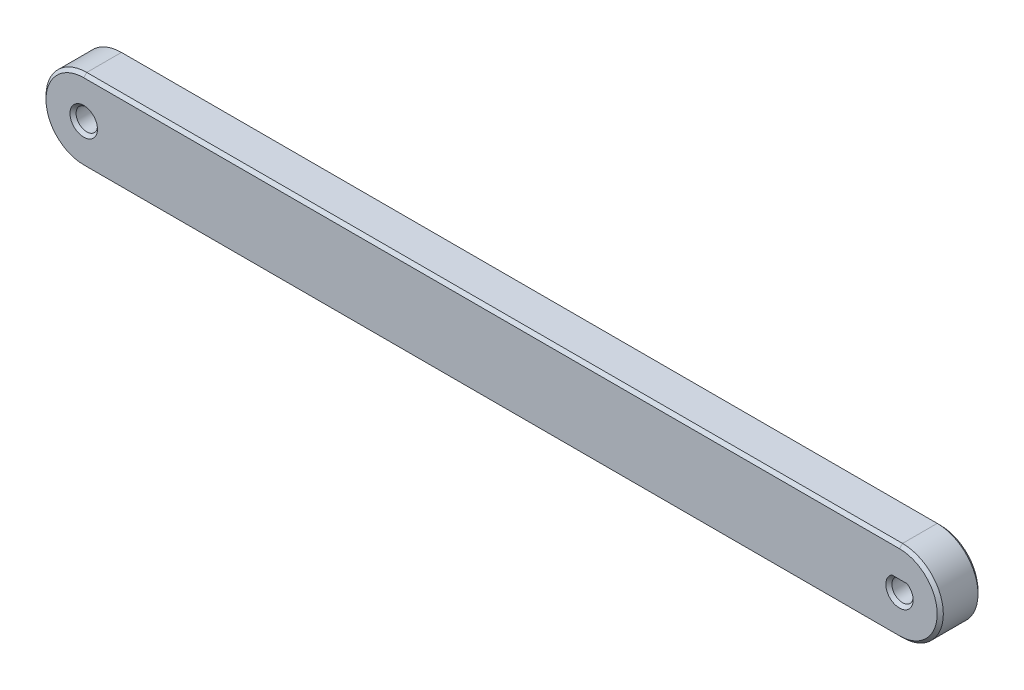
from build123d import *

# Parameters (mm, degrees)
SKETCH1_R           = 2.625
BOSS_EXTRUDE1_DEPTH = 10
SKETCH2_R           = 6.5
CUT_EXTRUDE1_DEPTH  = 4
CHAMFER1_SIZE       = 0.75


with BuildPart() as part:
    # Sketch1 → Boss-Extrude1 (new body)
    with BuildSketch(Plane.XY):
        with BuildLine():
            Line((100, 10), (-100, 10))
            ThreePointArc((-100, 10), (-110, 0), (-100, -10))
            Line((-100, -10), (100, -10))
            ThreePointArc((100, -10), (110, 0), (100, 10))
        make_face()
        with Locations((-100, 0)):
            Circle(SKETCH1_R, mode=Mode.SUBTRACT)
        with BuildLine():
            Line((98.338675227, 2), (101.661324773, 2))
            ThreePointArc((101.661324773, 2), (100, -2.6), (98.338675227, 2))
        make_face(mode=Mode.SUBTRACT)
    extrude(amount=BOSS_EXTRUDE1_DEPTH)

    # Sketch2 → Cut-Extrude1 (cut)
    with BuildSketch(Plane(origin=(0, 0, 0), x_dir=(-1, 0, 0), z_dir=(0, 0, -1))):
        with Locations((100, 0)):
            Circle(SKETCH2_R)
    extrude(amount=-CUT_EXTRUDE1_DEPTH, mode=Mode.SUBTRACT)

    # Chamfer1
    chamfer1_edges = [part.edges().sort_by_distance(p)[0] for p in [
        (-110, 0, 0),
        (0, 10, 0),
        (110, 0, 0),
        (110, 0, 10),
        (0, -10, 0),
        (0, 10, 10),
        (-110, 0, 10),
        (-102.625, 0, 4),
        (-93.5, 0, 0),
        (-102.625, 0, 10),
        (100, -2.6, 10),
        (100, 2, 10),
        (0, -10, 10),
        (100, 2, 0),
        (100, -2.6, 0),
    ]]
    chamfer(chamfer1_edges, length=CHAMFER1_SIZE)


solid = part.part
